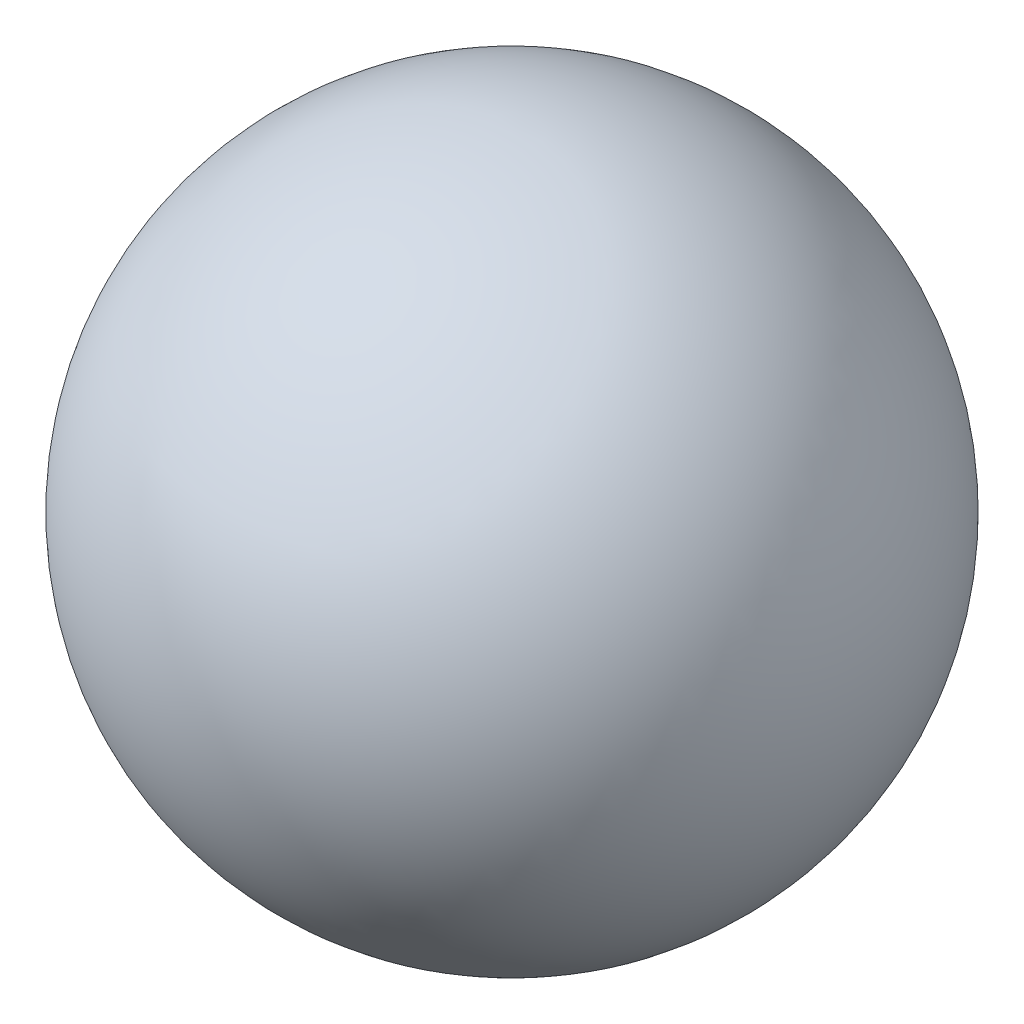
from build123d import *


with BuildPart() as part:
    # Sketch1 → Revolve1 (revolve)
    with BuildSketch(Plane.XY):
        with BuildLine():
            ThreePointArc((0, 11.5), (5.75, 5.75), (0, 0))
            Line((0, 0), (0, 11.5))
        make_face()
    revolve(axis=Axis((0, 0, 0), (0, 1, 0)))


solid = part.part
